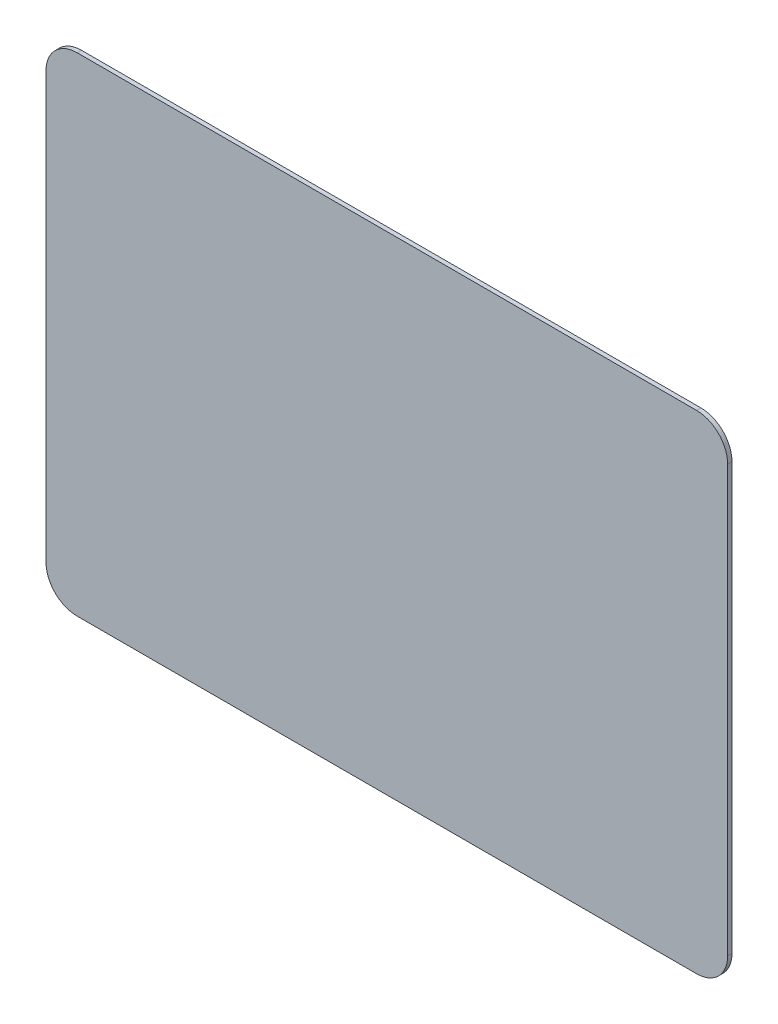
from build123d import *

# Parameters (mm, degrees)
BOSS_EXTRUDE1_DEPTH = 2.286


with BuildPart() as part:
    # Sketch1 → Boss-Extrude1 (new body)
    with BuildSketch(Plane.XY):
        with BuildLine():
            Line((-177.403473858, -145.114240437), (151.526526142, -145.114240437))
            ThreePointArc((151.526526142, -145.114240437), (163.2008591, -140.278573395), (168.036526142, -128.604240437))
            Line((168.036526142, -128.604240437), (168.036526142, 97.455759563))
            ThreePointArc((168.036526142, 97.455759563), (163.2008591, 109.13009252), (151.526526142, 113.965759563))
            Line((151.526526142, 113.965759563), (-177.403473858, 113.965759563))
            ThreePointArc((-177.403473858, 113.965759563), (-189.077806815, 109.13009252), (-193.913473858, 97.455759563))
            Line((-193.913473858, 97.455759563), (-193.913473858, -128.604240437))
            ThreePointArc((-193.913473858, -128.604240437), (-189.077806815, -140.278573395), (-177.403473858, -145.114240437))
        make_face()
    extrude(amount=BOSS_EXTRUDE1_DEPTH)


solid = part.part
